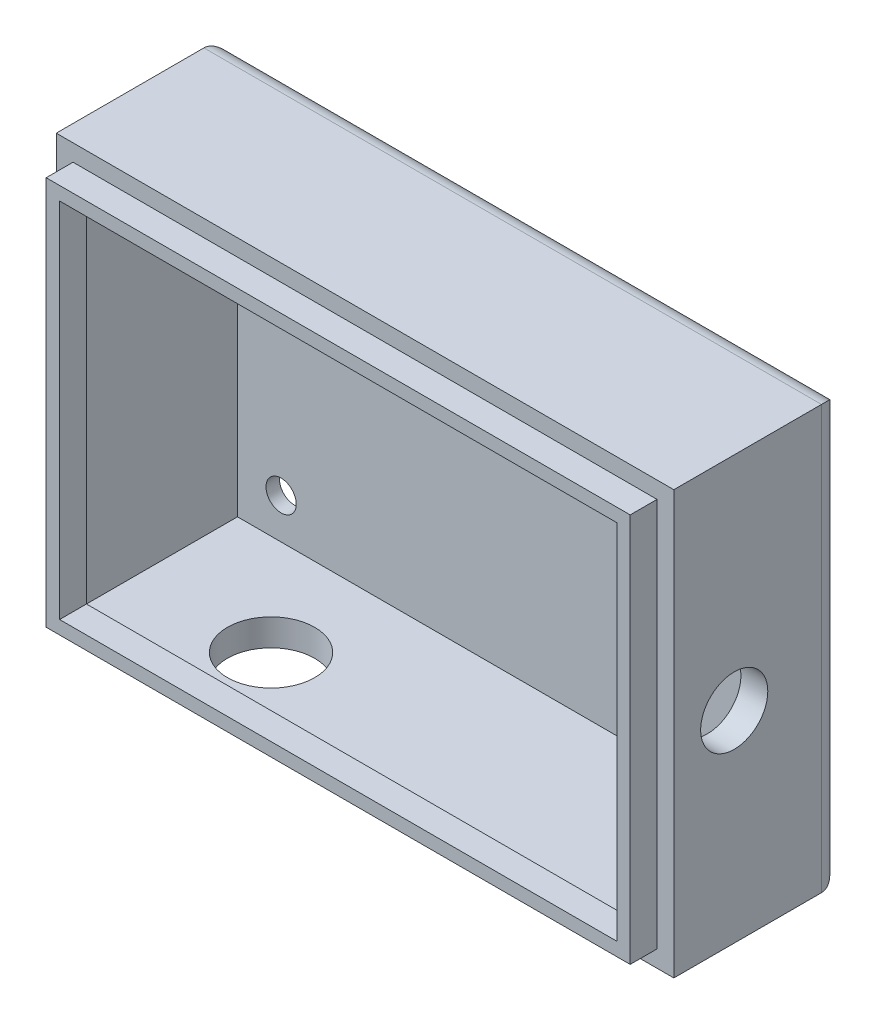
from build123d import *

# Parameters (mm, degrees)
SKETCH3_W           = 92
SKETCH3_H           = 63
SKETCH3_R           = 2.25
BOSS_EXTRUDE3_DEPTH = 25
SKETCH4_W           = 84
SKETCH4_H           = 55
CUT_EXTRUDE1_DEPTH  = 23
FILLET1_R           = 3
SKETCH5_W           = 87
SKETCH5_H           = 58
BOSS_EXTRUDE4_DEPTH = 4
SKETCH7_W           = 83
SKETCH7_H           = 54
CUT_EXTRUDE4_DEPTH  = 27
SKETCH9_R           = 6.5
CUT_EXTRUDE6_DEPTH  = 27
SKETCH11_R          = 5
CUT_EXTRUDE7_DEPTH  = 27


with BuildPart() as part:
    # Sketch3 → Boss-Extrude3 (new body)
    with BuildSketch(Plane.XY):
        with Locations((46, 31.5)):
            Rectangle(SKETCH3_W, SKETCH3_H)
        with Locations((82, 53)):
            Circle(SKETCH3_R, mode=Mode.SUBTRACT)
        with Locations((82, 10)):
            Circle(SKETCH3_R, mode=Mode.SUBTRACT)
        with Locations((10.5, 10)):
            Circle(SKETCH3_R, mode=Mode.SUBTRACT)
        with Locations((10.5, 53)):
            Circle(SKETCH3_R, mode=Mode.SUBTRACT)
    extrude(amount=BOSS_EXTRUDE3_DEPTH)

    # Sketch4 → Cut-Extrude1 (cut)
    with BuildSketch(Plane.XY.offset(25)):
        with Locations((46, 31.5)):
            Rectangle(SKETCH4_W, SKETCH4_H)
    extrude(amount=-CUT_EXTRUDE1_DEPTH, mode=Mode.SUBTRACT)

    # Fillet1
    fillet1_edges = [part.edges().sort_by_distance(p)[0] for p in [
        (46, 63, 0),
        (92, 31.5, 0),
        (46, 0, 0),
        (0, 31.5, 0),
    ]]
    fillet(fillet1_edges, radius=FILLET1_R)

    # Sketch5 → Boss-Extrude4 (add)
    with BuildSketch(Plane.XY.offset(25)):
        with Locations((46, 31.5)):
            Rectangle(SKETCH5_W, SKETCH5_H)
    extrude(amount=BOSS_EXTRUDE4_DEPTH)

    # Sketch7 → Cut-Extrude4 (cut)
    with BuildSketch(Plane.XY.offset(29)):
        with Locations((46, 31.5)):
            Rectangle(SKETCH7_W, SKETCH7_H)
    extrude(amount=-CUT_EXTRUDE4_DEPTH, mode=Mode.SUBTRACT)

    # Sketch9 → Cut-Extrude6 (cut)
    with BuildSketch(Plane.XZ):
        with Locations(Location((24, 17, 0), (0, 0, 270))):
            Circle(SKETCH9_R)
    extrude(amount=-CUT_EXTRUDE6_DEPTH, mode=Mode.SUBTRACT)

    # Sketch11 → Cut-Extrude7 (cut)
    with BuildSketch(Plane(origin=(92, 0, 0), x_dir=(0, 0, -1), z_dir=(1, 0, 0))):
        with Locations((-16, 30)):
            Circle(SKETCH11_R)
    extrude(amount=-CUT_EXTRUDE7_DEPTH, mode=Mode.SUBTRACT)


solid = part.part
